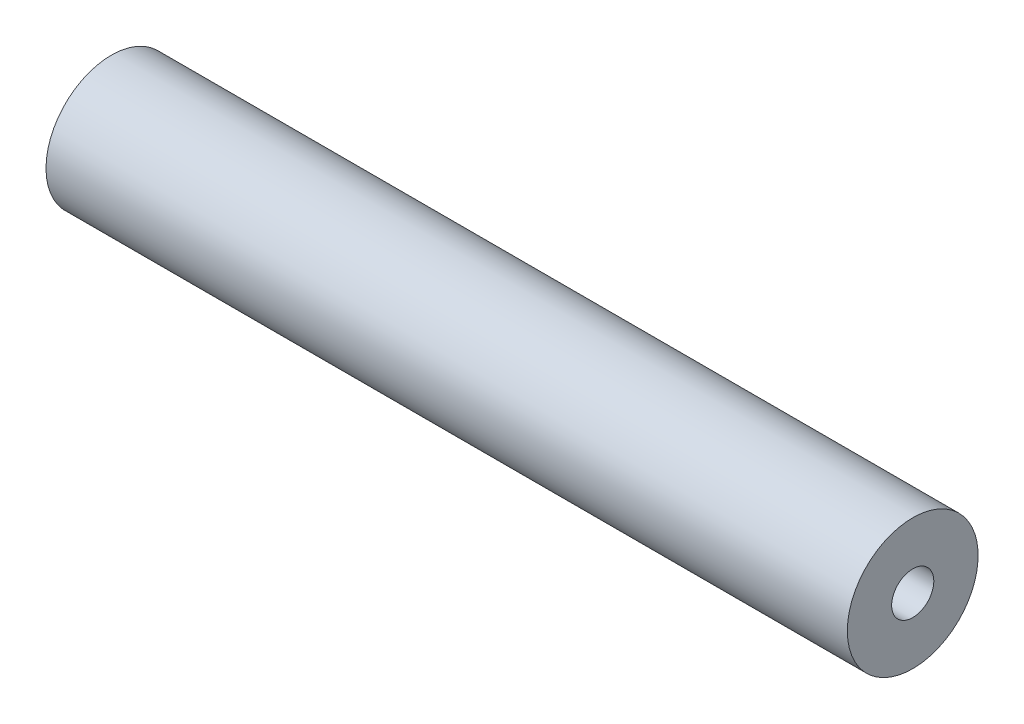
from build123d import *

# Parameters (mm, degrees)
IZIM1_W               = 152
IZIM1_H               = 12.405405405
IZIM2_R               = 4
KES_EKSTR_ZYON1_DEPTH = 21
KES_EKSTR_ZYON2_START = -21
KES_EKSTR_ZYON2_DEPTH = 21


with BuildPart() as part:
    # Çizim1 → Döndür1 (revolve)
    with BuildSketch(Plane(origin=(0, 0, 0), x_dir=(-1, 0, 0), z_dir=(0, 0, -1)), mode=Mode.PRIVATE) as d_nd_r1_sk:
        with Locations((-77, 6.202702703)):
            Rectangle(IZIM1_W, IZIM1_H)
    revolve(d_nd_r1_sk.sketch.rotate(Axis((153, 0, 0), (-1, 0, 0)), 270), axis=Axis((153, 0, 0), (-1, 0, 0)))

    # Çizim2 → Kes-Ekstrüzyon1 (cut)
    with BuildSketch(Plane(origin=(153, 0, 0), x_dir=(0, 0, -1), z_dir=(1, 0, 0))):
        Circle(IZIM2_R)
    extrude(amount=-KES_EKSTR_ZYON1_DEPTH, mode=Mode.SUBTRACT)

    # Çizim3 → Kes-Ekstrüzyon2 (cut)
    with BuildSketch(Plane.ZY.offset(-1).offset(KES_EKSTR_ZYON2_START)):
        with BuildLine():
            ThreePointArc((1.5, -3.708099244), (0, 4), (-1.5, -3.708099244))
            ThreePointArc((-1.5, -3.708099244), (0, -4), (1.5, -3.708099244))
        make_face()
    extrude(amount=KES_EKSTR_ZYON2_DEPTH, mode=Mode.SUBTRACT)


solid = part.part
